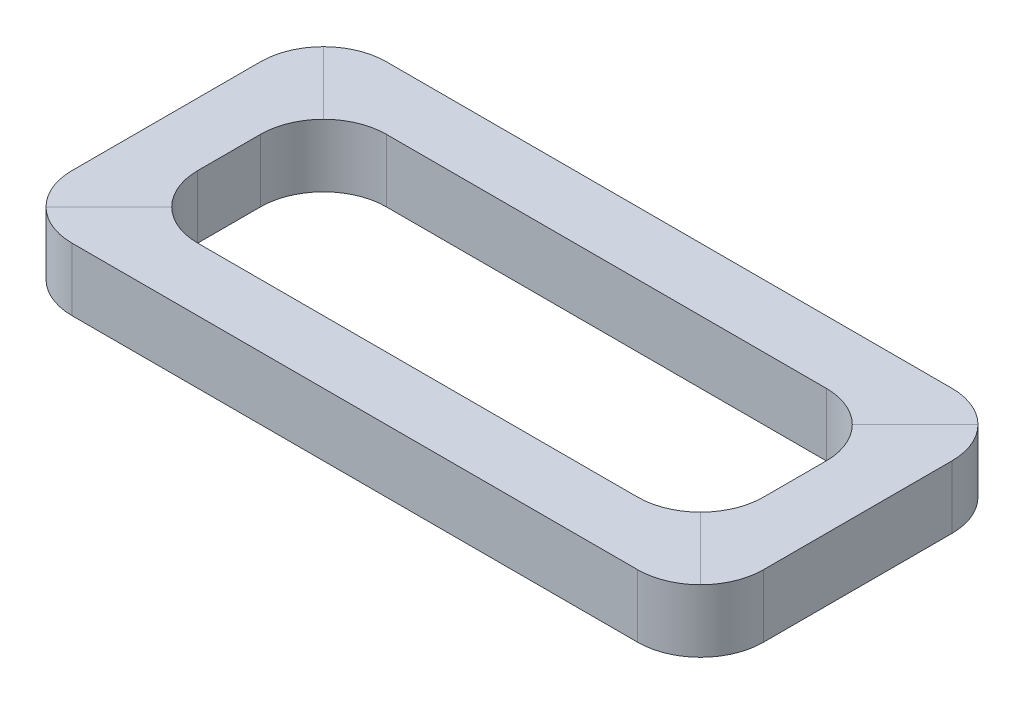
from build123d import *

# Parameters (mm, degrees)
SKETCH3_W = 5
SKETCH3_H = 5
FILLET1_R = 5


with BuildPart() as part:
    # Sweep2: sweep along a path in Sketch4
    with BuildLine(Plane(origin=(0, 0, 0), x_dir=(1, 0, 0), z_dir=(0, 1, 0))) as sweep2_path:
        Line((0, 0), (50, 0))
        Line((50, 0), (50, -20))
        Line((50, -20), (0, -20))
        Line((0, -20), (0, 0))
    # Sketch3 → Sweep2 (sweep)
    with BuildSketch(Plane(origin=(0, 0, 0), x_dir=(0, 0, -1), z_dir=(1, 0, 0))):
        Rectangle(SKETCH3_W, SKETCH3_H)
    sweep(path=sweep2_path.line, transition=Transition.RIGHT)

    # Fillet1
    fillet1_edges = [part.edges().sort_by_distance(p)[0] for p in [
        (-2.5, 0, 22.5),
        (2.5, 0, 17.5),
        (47.5, 0, 2.5),
        (52.5, 0, -2.5),
        (-2.5, 0, -2.5),
        (2.5, 0, 2.5),
        (52.5, 0, 22.5),
        (47.5, 0, 17.5),
    ]]
    fillet(fillet1_edges, radius=FILLET1_R)


solid = part.part
